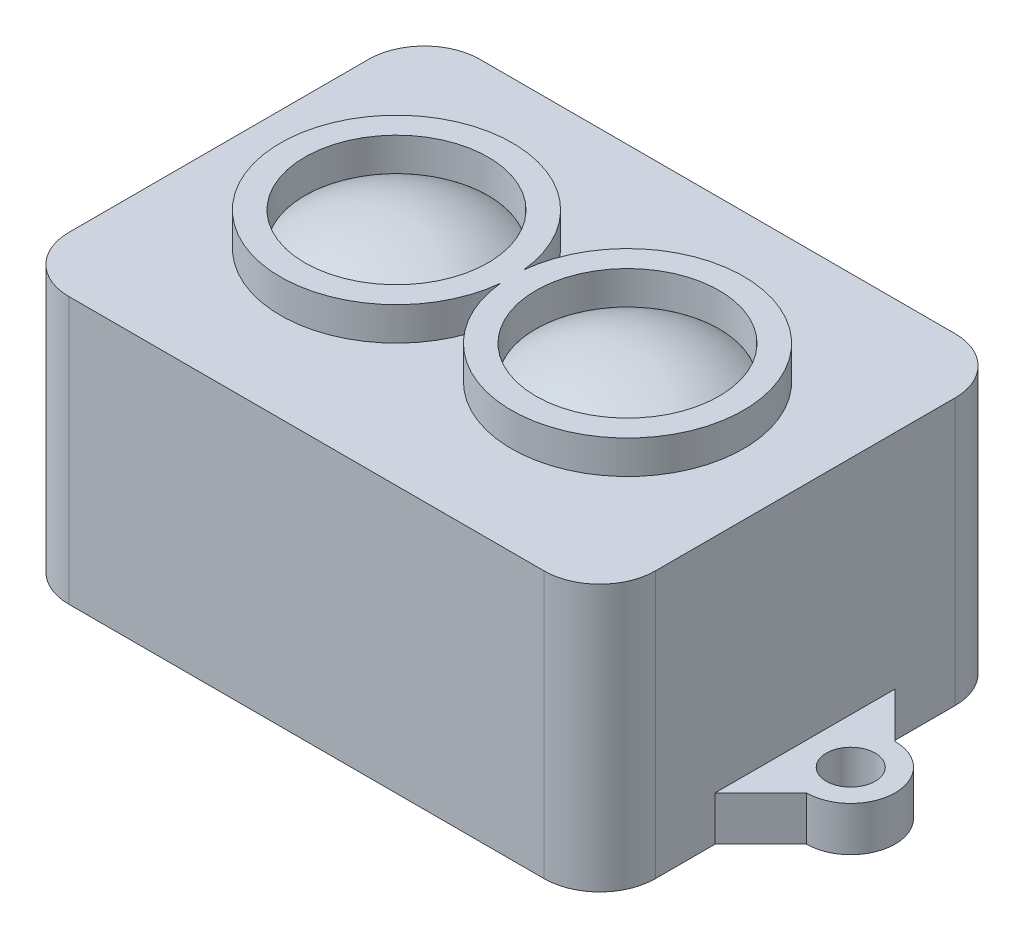
from build123d import *

# Parameters (mm, degrees)
SKETCH2_R           = 1.1
BOSS_EXTRUDE1_DEPTH = 2
BOSS_EXTRUDE2_DEPTH = 10
BOSS_EXTRUDE3_START = -2
BOSS_EXTRUDE3_DEPTH = 2
SKETCH5_R           = 4.125
BOSS_EXTRUDE4_DEPTH = 1.5


with BuildPart() as part:
    # Sketch2 → Boss-Extrude1 (new body)
    with BuildSketch(Plane(origin=(0, 0, 0), x_dir=(1, 0, 0), z_dir=(0, 1, 0))):
        with BuildLine():
            Line((-10.7, -9.25), (10.7, -9.25))
            ThreePointArc((10.7, -9.25), (12.467766953, -8.517766953), (13.2, -6.75))
            Line((13.2, -6.75), (13.2, -4.05))
            Line((13.2, -4.05), (15.25, -2))
            ThreePointArc((15.25, -2), (17.25, 0), (15.25, 2))
            Line((15.25, 2), (13.2, 4.05))
            Line((13.2, 4.05), (13.2, 6.75))
            ThreePointArc((13.2, 6.75), (12.467766953, 8.517766953), (10.7, 9.25))
            Line((10.7, 9.25), (-10.7, 9.25))
            ThreePointArc((-10.7, 9.25), (-12.467766953, 8.517766953), (-13.2, 6.75))
            Line((-13.2, 6.75), (-13.2, 4.05))
            Line((-13.2, 4.05), (-15.25, 2))
            ThreePointArc((-15.25, 2), (-17.25, 0), (-15.25, -2))
            Line((-15.25, -2), (-13.2, -4.05))
            Line((-13.2, -4.05), (-13.2, -6.75))
            ThreePointArc((-13.2, -6.75), (-12.467766953, -8.517766953), (-10.7, -9.25))
        make_face()
        with Locations(Location((-15.25, 0, 0), (0, 0, 270))):
            Circle(SKETCH2_R, mode=Mode.SUBTRACT)
        with Locations(Location((15.25, 0, 0), (0, 0, 270))):
            Circle(SKETCH2_R, mode=Mode.SUBTRACT)
        with BuildLine():
            Line((-10.7, 7.95), (10.7, 7.95))
            ThreePointArc((10.7, 7.95), (11.548528137, 7.598528137), (11.9, 6.75))
            Line((11.9, 6.75), (11.9, -6.75))
            ThreePointArc((11.9, -6.75), (11.548528137, -7.598528137), (10.7, -7.95))
            Line((10.7, -7.95), (-10.7, -7.95))
            ThreePointArc((-10.7, -7.95), (-11.548528137, -7.598528137), (-11.9, -6.75))
            Line((-11.9, -6.75), (-11.9, 6.75))
            ThreePointArc((-11.9, 6.75), (-11.548528137, 7.598528137), (-10.7, 7.95))
        make_face(mode=Mode.SUBTRACT)
    extrude(amount=BOSS_EXTRUDE1_DEPTH)

    # Sketch3 → Boss-Extrude2 (add)
    with BuildSketch(Plane(origin=(0, 2, 0), x_dir=(1, 0, 0), z_dir=(0, 1, 0))):
        with BuildLine():
            Line((-13.2, 6.75), (-13.2, -6.75))
            ThreePointArc((-13.2, -6.75), (-12.467766953, -8.517766953), (-10.7, -9.25))
            Line((-10.7, -9.25), (10.7, -9.25))
            ThreePointArc((10.7, -9.25), (12.467766953, -8.517766953), (13.2, -6.75))
            Line((13.2, -6.75), (13.2, 6.75))
            ThreePointArc((13.2, 6.75), (12.467766953, 8.517766953), (10.7, 9.25))
            Line((10.7, 9.25), (-10.7, 9.25))
            ThreePointArc((-10.7, 9.25), (-12.467766953, 8.517766953), (-13.2, 6.75))
        make_face()
        with BuildLine():
            Line((-10.7, 7.95), (10.7, 7.95))
            ThreePointArc((10.7, 7.95), (11.548528137, 7.598528137), (11.9, 6.75))
            Line((11.9, 6.75), (11.9, -6.75))
            ThreePointArc((11.9, -6.75), (11.548528137, -7.598528137), (10.7, -7.95))
            Line((10.7, -7.95), (-10.7, -7.95))
            ThreePointArc((-10.7, -7.95), (-11.548528137, -7.598528137), (-11.9, -6.75))
            Line((-11.9, -6.75), (-11.9, 6.75))
            ThreePointArc((-11.9, 6.75), (-11.548528137, 7.598528137), (-10.7, 7.95))
        make_face(mode=Mode.SUBTRACT)
    extrude(amount=BOSS_EXTRUDE2_DEPTH)

    # Sketch4 → Boss-Extrude3 (add)
    with BuildSketch(Plane(origin=(0, 12, 0), x_dir=(1, 0, 0), z_dir=(0, 1, 0)).offset(BOSS_EXTRUDE3_START)):
        with BuildLine():
            Line((-10.7, 9.25), (10.7, 9.25))
            ThreePointArc((10.7, 9.25), (12.467766953, 8.517766953), (13.2, 6.75))
            Line((13.2, 6.75), (13.2, -6.75))
            ThreePointArc((13.2, -6.75), (12.467766953, -8.517766953), (10.7, -9.25))
            Line((10.7, -9.25), (-10.7, -9.25))
            ThreePointArc((-10.7, -9.25), (-12.467766953, -8.517766953), (-13.2, -6.75))
            Line((-13.2, -6.75), (-13.2, 6.75))
            ThreePointArc((-13.2, 6.75), (-12.467766953, 8.517766953), (-10.7, 9.25))
        make_face()
    extrude(amount=BOSS_EXTRUDE3_DEPTH)

    # Sketch5 → Boss-Extrude4 (add)
    with BuildSketch(Plane(origin=(0, 12, 0), x_dir=(1, 0, 0), z_dir=(0, 1, 0))):
        with BuildLine():
            ThreePointArc((0, 0.510514446), (-10.425, 0), (0, -0.510514446))
            ThreePointArc((0, -0.510514446), (10.425, 0), (0, 0.510514446))
        make_face()
        with Locations(Location((-5.2, 0, 0), (0, 0, 270))):
            Circle(SKETCH5_R, mode=Mode.SUBTRACT)
        with Locations(Location((5.2, 0, 0), (0, 0, 270))):
            Circle(SKETCH5_R, mode=Mode.SUBTRACT)
    extrude(amount=BOSS_EXTRUDE4_DEPTH)


with BuildPart() as body_2:
    # Sketch7 → Revolve1 (revolve)
    with BuildSketch(Plane.XY):
        with BuildLine():
            Line((-5.2, 13.3), (-5.2, 12))
            Line((-5.2, 12), (-9.325, 12))
            ThreePointArc((-9.325, 12), (-7.3625, 12.967307692), (-5.2, 13.3))
        make_face()
    revolve(axis=Axis((-5.2, 13.3, 0), (0, 1, 0)))


with BuildPart() as body_3:
    # Mirror1: mirrored copy
    add(body_2.part.mirror(Plane(origin=(0, 0, 0), x_dir=(0, 0, 1), z_dir=(1, 0, 0))))


solid = Compound([part.part, body_2.part, body_3.part])
